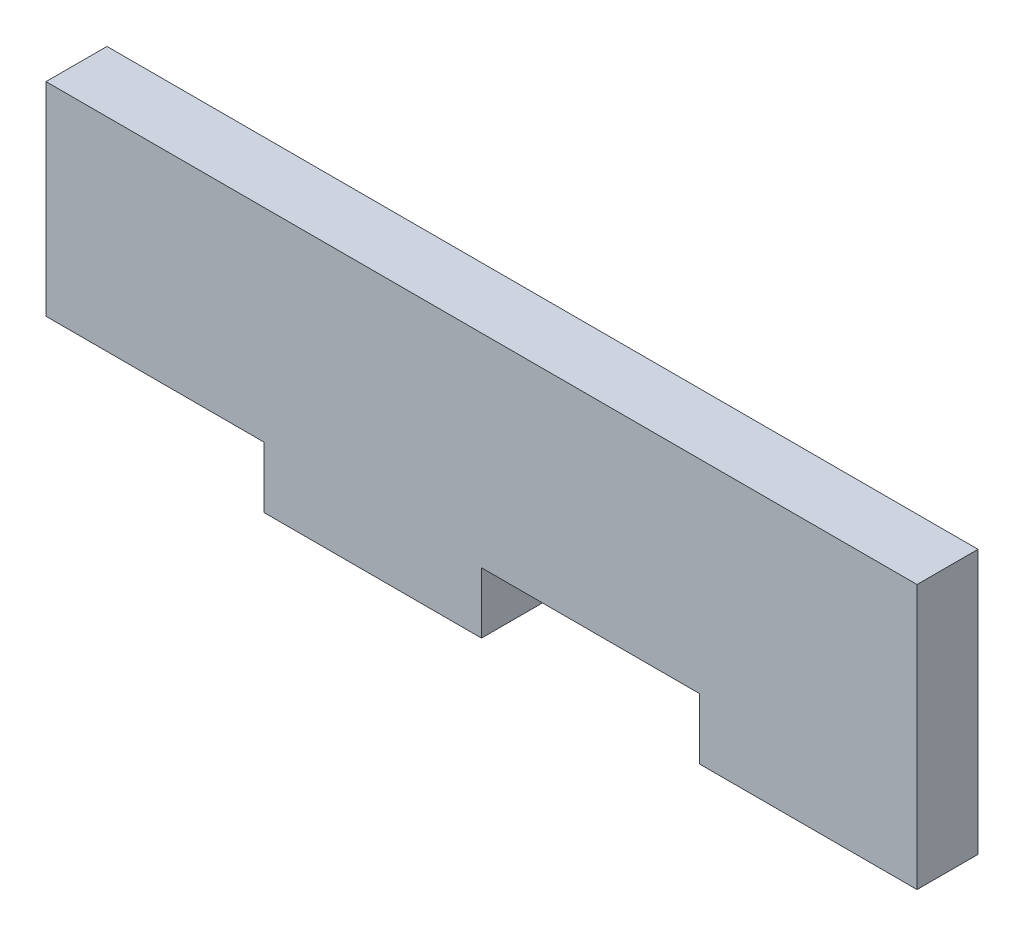
from build123d import *

# Parameters (mm, degrees)
SKETCH1_W           = 76.2
SKETCH1_H           = 23.114
BOSS_EXTRUDE1_DEPTH = 5.334
SKETCH2_W           = 19.05
SKETCH2_H           = 5.334
CUT_EXTRUDE1_DEPTH  = 478.783096008


with BuildPart() as part:
    # Sketch1 → Boss-Extrude1 (new body)
    with BuildSketch(Plane.XY):
        with Locations((-344.780730467, 274.18865878)):
            Rectangle(SKETCH1_W, SKETCH1_H)
    extrude(amount=BOSS_EXTRUDE1_DEPTH)

    # Sketch2 → Cut-Extrude1 (cut, through all)
    with BuildSketch(Plane.XY.offset(5.334)):
        with Locations((-373.355730467, 265.29865878)):
            Rectangle(SKETCH2_W, SKETCH2_H)
        with Locations((-335.255730467, 265.29865878)):
            Rectangle(SKETCH2_W, SKETCH2_H)
    extrude(amount=-CUT_EXTRUDE1_DEPTH, mode=Mode.SUBTRACT)


solid = part.part
